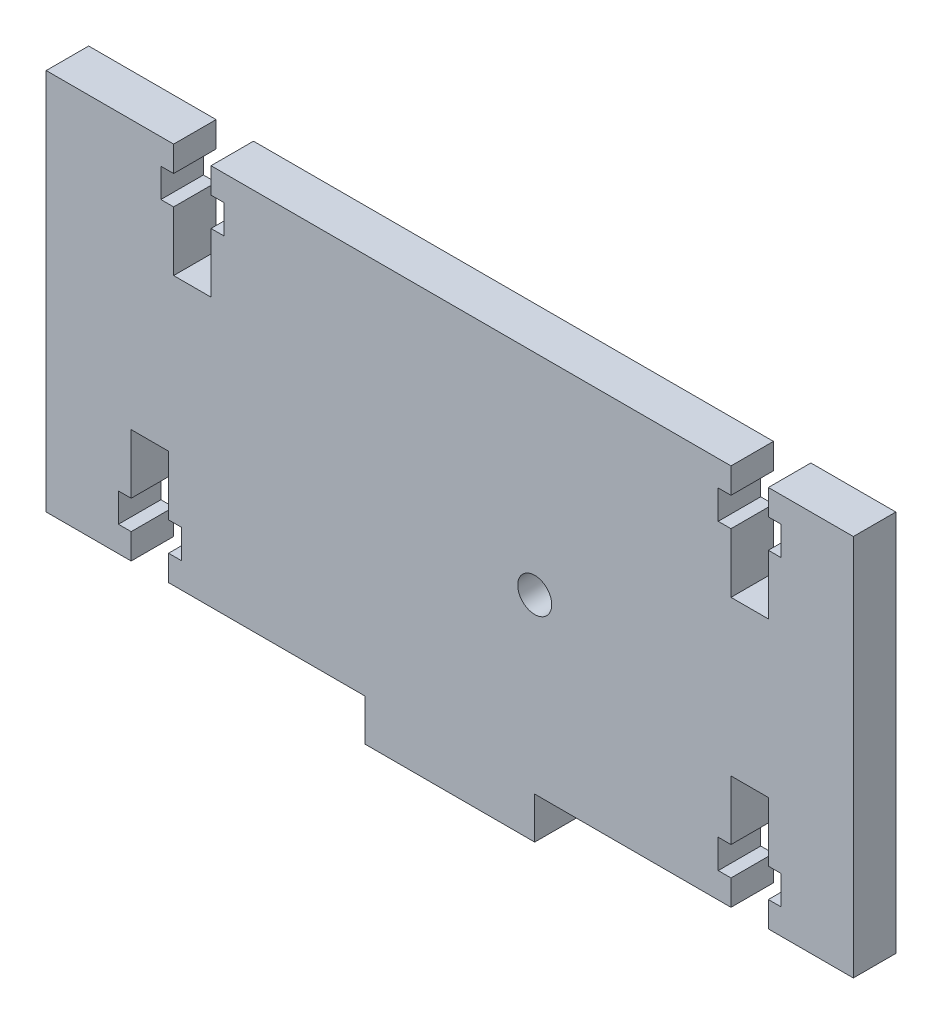
from build123d import *

# Parameters (mm, degrees)
BOSS_EXTRUDE1_DEPTH = 5
CUT_EXTRUDE1_DEPTH  = 5
SKETCH4_R           = 2
CUT_EXTRUDE2_DEPTH  = 5


with BuildPart() as part:
    # Sketch1 → Boss-Extrude1 (new body)
    with BuildSketch(Plane.XY):
        Polygon((10, -22.5), (47.5, -22.5), (47.5, 22.5), (-47.5, 22.5), (-47.5, -22.5), (-10, -22.5), (-10, -27.4), (10, -27.4), align=None)
    extrude(amount=BOSS_EXTRUDE1_DEPTH)

    # Sketch3 → Cut-Extrude1 (cut)
    with BuildSketch(Plane.XY.offset(5)):
        Polygon((-33.1, -19.5), (-33.1, -22.5), (-37.5, -22.5), (-37.5, -19.5), (-39, -19.5), (-39, -16.1), (-37.5, -16.1), (-37.5, -9.1), (-33.1, -9.1), (-33.1, -16.1), (-31.6, -16.1), (-31.6, -19.5), align=None)
        Polygon((37.5, -22.5), (37.5, -19.5), (39, -19.5), (39, -16.1), (37.5, -16.1), (37.5, -9.1), (33.1, -9.1), (33.1, -16.1), (31.6, -16.1), (31.6, -19.5), (33.1, -19.5), (33.1, -22.5), align=None)
        Polygon((33.1, 19.5), (33.1, 22.5), (37.5, 22.5), (37.5, 19.5), (39, 19.5), (39, 16.1), (37.5, 16.1), (37.5, 9.1), (33.1, 9.1), (33.1, 16.1), (31.6, 16.1), (31.6, 19.5), align=None)
        Polygon((-32.5, 19.5), (-32.5, 22.5), (-28.1, 22.5), (-28.1, 19.5), (-26.6, 19.5), (-26.6, 16.1), (-28.1, 16.1), (-28.1, 9.1), (-32.5, 9.1), (-32.5, 16.1), (-34, 16.1), (-34, 19.5), align=None)
    extrude(amount=-CUT_EXTRUDE1_DEPTH, mode=Mode.SUBTRACT)

    # Sketch4 → Cut-Extrude2 (cut)
    with BuildSketch(Plane.XY.offset(5)):
        with Locations((10, -2.2)):
            Circle(SKETCH4_R)
    extrude(amount=-CUT_EXTRUDE2_DEPTH, mode=Mode.SUBTRACT)


solid = part.part
